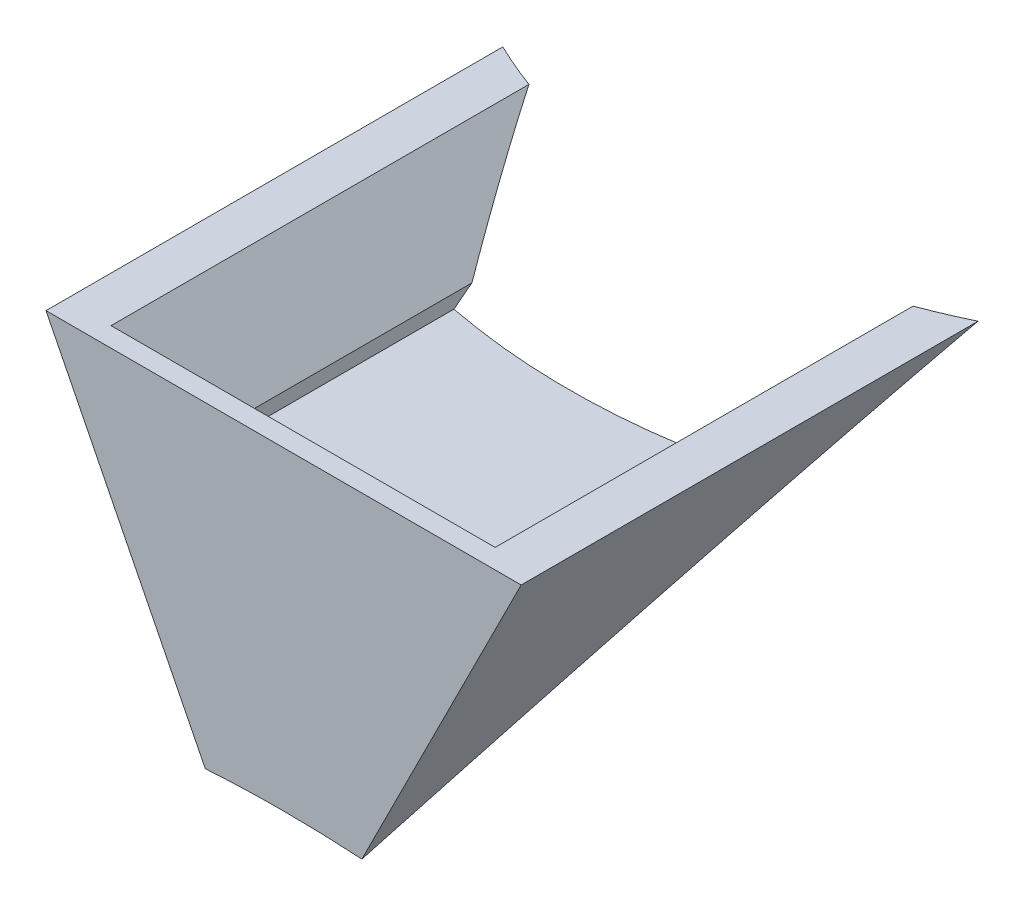
from build123d import *

# Parameters (mm, degrees)
BOSS_EXTRU_5_START       = 146
BOSS_EXTRU_5_DEPTH       = 71.6
ENL_V_START              = 143
ENL_V_MAT_EXTRU_16_DEPTH = 68.8
ENL_V_MAT_EXTRU_17_DEPTH = 12.75


with BuildPart() as part:
    # Esquisse21 → Boss.-Extru.5 (new body)
    with BuildSketch(Plane.XY.offset(BOSS_EXTRU_5_START)):
        Polygon((0, 61.14881388), (36.516512378, 61.14881388), (7.78303179, 3.954740649), (0, 3.954740649), (-7.78303179, 3.954740649), (-36.516512378, 61.14881388), align=None)
    extrude(amount=-BOSS_EXTRU_5_DEPTH)

    # Esquisse25 → Enlèv. mat.-Extru.16 (cut)
    with BuildSketch(Plane.XY.offset(ENL_V_START)):
        Polygon((-19.487098976, 47.02133199), (20.512901024, 47.02133199), (20.512901024, 49.136323087), (29.516512378, 61.14881388), (-29.516512378, 61.14881388), (-19.487098976, 49.136323087), align=None)
    extrude(amount=-ENL_V_MAT_EXTRU_16_DEPTH, mode=Mode.SUBTRACT)

    # Esquisse28 → Enlèvement de matière-Révolution1 (revolve, cut)
    with BuildSketch(Plane.XY):
        Polygon((0, 80), (0, -62.094926462), (151.911852074, -62.094926462), (151.911852074, 8.180052285), (60, 80), align=None)
    revolve(axis=Axis((0, 178.385130013, 0), (0, -1, 0)), mode=Mode.SUBTRACT)

    # Esquisse29 → Enlèv. mat.-Extru.17 (cut, symmetric)
    with BuildSketch(Plane(origin=(0, 0, 0), x_dir=(0, 0, -1), z_dir=(1, 0, 0))):
        Polygon((-140.809307475, 42.678321443), (-140.809307475, 21.477456774), (-113.038923412, 42.678321443), align=None)
    extrude(amount=ENL_V_MAT_EXTRU_17_DEPTH, both=True, mode=Mode.SUBTRACT)


solid = part.part
